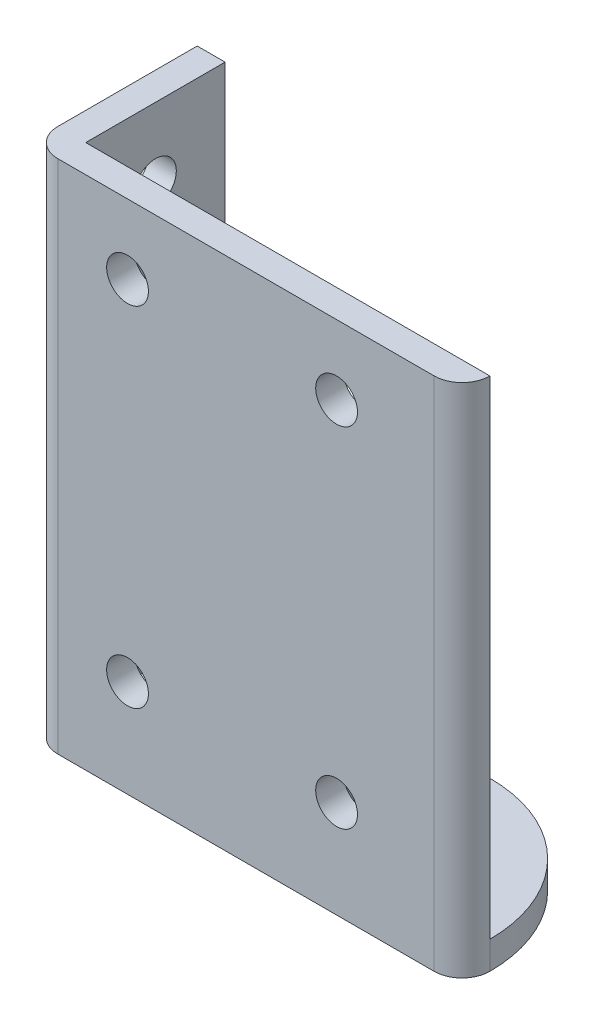
from build123d import *

# Parameters (mm, degrees)
BOSS_EXTRUDE1_DEPTH = 4
BOSS_EXTRUDE2_DEPTH = 70
SKETCH3_R           = 3
CUT_EXTRUDE1_DEPTH  = 97.540147089
SKETCH4_R           = 3
CUT_EXTRUDE2_DEPTH  = 98.036075766
SKETCH6_R           = 3
CUT_EXTRUDE3_DEPTH  = 99.590060351


with BuildPart() as part:
    # Sketch1 → Boss-Extrude1 (new body)
    with BuildSketch(Plane(origin=(0, 0, 0), x_dir=(1, 0, 0), z_dir=(0, 1, 0))):
        with BuildLine():
            Line((0, 4), (0, 24))
            Line((0, 24), (42, 24))
            ThreePointArc((42, 24), (56.142135624, 18.142135624), (62, 4))
            ThreePointArc((62, 4), (60.828427125, 1.171572875), (58, 0))
            Line((58, 0), (4, 0))
            ThreePointArc((4, 0), (1.171572875, 1.171572875), (0, 4))
        make_face()
    extrude(amount=BOSS_EXTRUDE1_DEPTH)

    # Sketch2 → Boss-Extrude2 (add)
    with BuildSketch(Plane(origin=(0, 4, 0), x_dir=(1, 0, 0), z_dir=(0, 1, 0))):
        with BuildLine():
            Line((4, 24), (4, 4))
            Line((4, 4), (62, 4))
            ThreePointArc((62, 4), (60.828427125, 1.171572875), (58, 0))
            Line((58, 0), (4, 0))
            ThreePointArc((4, 0), (1.171572875, 1.171572875), (0, 4))
            Line((0, 4), (0, 24))
            Line((0, 24), (4, 24))
        make_face()
    extrude(amount=BOSS_EXTRUDE2_DEPTH)

    # Sketch3 → Cut-Extrude1 (cut, through all)
    with BuildSketch(Plane(origin=(0, 4, 0), x_dir=(1, 0, 0), z_dir=(0, 1, 0))):
        with Locations(Location((34, 14, 0), (0, 0, 270))):
            Circle(SKETCH3_R)
    extrude(amount=-CUT_EXTRUDE1_DEPTH, mode=Mode.SUBTRACT)

    # Sketch4 → Cut-Extrude2 (cut, through all)
    with BuildSketch(Plane(origin=(4, 0, 0), x_dir=(0, 0, -1), z_dir=(1, 0, 0))):
        with Locations((14, 64)):
            Circle(SKETCH4_R)
        with Locations((14, 14)):
            Circle(SKETCH4_R)
    extrude(amount=-CUT_EXTRUDE2_DEPTH, mode=Mode.SUBTRACT)

    # Sketch6 → Cut-Extrude3 (cut, through all)
    with BuildSketch(Plane(origin=(0, 0, -4), x_dir=(-1, 0, 0), z_dir=(0, 0, -1))):
        with Locations((-14, 14)):
            Circle(SKETCH6_R)
        with Locations((-44, 14)):
            Circle(SKETCH6_R)
        with Locations((-14, 64)):
            Circle(SKETCH6_R)
        with Locations((-44, 64)):
            Circle(SKETCH6_R)
    extrude(amount=-CUT_EXTRUDE3_DEPTH, mode=Mode.SUBTRACT)


solid = part.part
